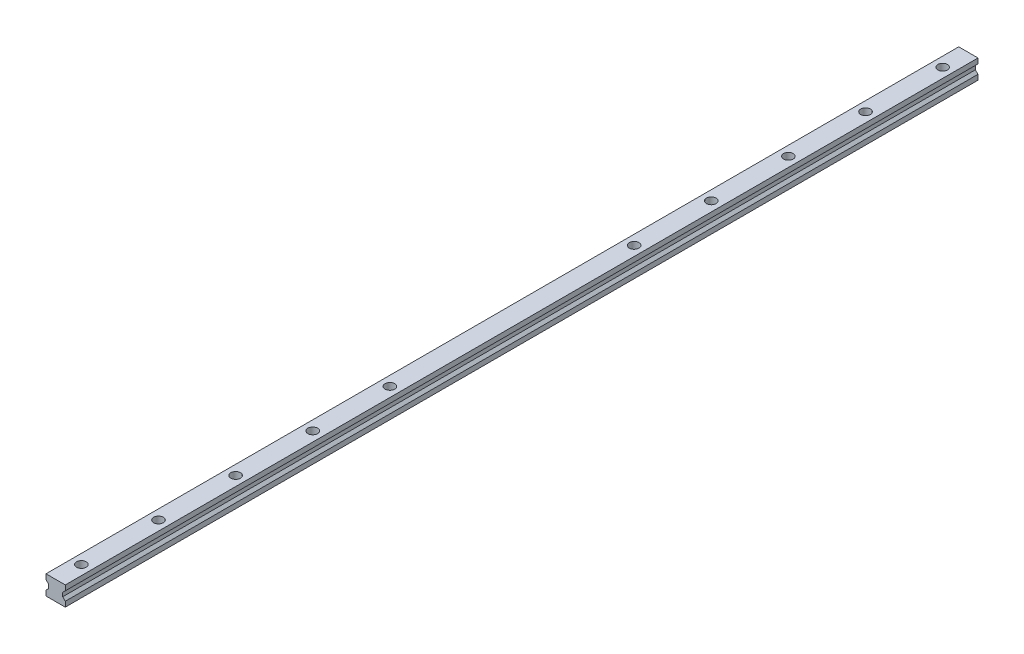
from build123d import *

# Parameters (mm, degrees)
BOSS_EXTRUDE1_DEPTH = 710
SKETCH2_R           = 3.75
CUT_EXTRUDE1_DEPTH  = 5.3
SKETCH3_R           = 2.25
CUT_EXTRUDE2_DEPTH  = 711.198035762


with BuildPart() as part:
    # Sketch1 → Boss-Extrude1 (new body)
    with BuildSketch(Plane.XY):
        Polygon((-7.5, 0), (7.5, 0), (7.5, 4), (5.5, 6), (5.5, 9), (7.5, 11), (7.5, 15), (-7.5, 15), (-7.5, 11), (-5.5, 9), (-5.5, 6), (-7.5, 4), align=None)
    extrude(amount=BOSS_EXTRUDE1_DEPTH)

    # Sketch2 → Cut-Extrude1 (cut)
    with BuildSketch(Plane(origin=(0, 15, 0), x_dir=(1, 0, 0), z_dir=(0, 1, 0))):
        with Locations(Location((0, -20, 0), (0, 0, 270))):
            Circle(SKETCH2_R)
        with Locations(Location((0, -80, 0), (0, 0, 270))):
            Circle(SKETCH2_R)
        with Locations(Location((0, -140, 0), (0, 0, 270))):
            Circle(SKETCH2_R)
        with Locations(Location((0, -200, 0), (0, 0, 270))):
            Circle(SKETCH2_R)
        with Locations(Location((0, -260, 0), (0, 0, 270))):
            Circle(SKETCH2_R)
    cut_extrude1 = extrude(amount=-CUT_EXTRUDE1_DEPTH, mode=Mode.SUBTRACT)

    # Sketch3 → Cut-Extrude2 (cut, through all)
    with BuildSketch(Plane(origin=(0, 15, 0), x_dir=(1, 0, 0), z_dir=(0, 1, 0))):
        with Locations(Location((0, -20, 0), (0, 0, 270))):
            Circle(SKETCH3_R)
        with Locations(Location((0, -80, 0), (0, 0, 270))):
            Circle(SKETCH3_R)
        with Locations(Location((0, -140, 0), (0, 0, 270))):
            Circle(SKETCH3_R)
        with Locations(Location((0, -200, 0), (0, 0, 270))):
            Circle(SKETCH3_R)
        with Locations(Location((0, -260, 0), (0, 0, 270))):
            Circle(SKETCH3_R)
    extrude(amount=-CUT_EXTRUDE2_DEPTH, mode=Mode.SUBTRACT)

    # 镜向1: Cut-Extrude1 across plane
    add(cut_extrude1.mirror(Plane.XY.offset(355)), mode=Mode.SUBTRACT)


solid = part.part
